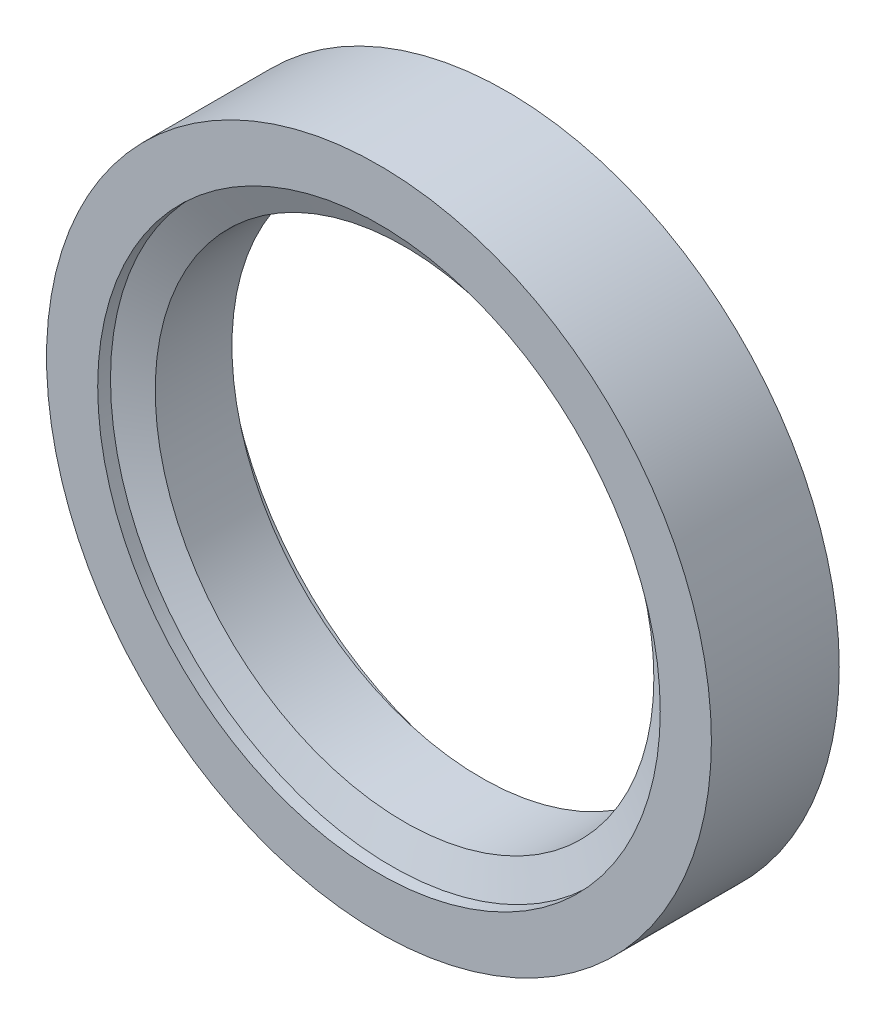
from build123d import *

# Parameters (mm, degrees)
EXTRUDE_1_DEPTH      = 5
EXTRUDE_1_DEPTH_BACK = 5
SKETCH_1_R           = 26
SKETCH_1_R_2         = 22


with BuildPart() as part:
    # Эскиз1 → Бобышка-Вытянуть1 (new, two sides: drawn at the far end of the back side and taken through both)
    with BuildSketch(Plane.XY.offset(-EXTRUDE_1_DEPTH_BACK)):
        Circle(SKETCH_1_R)
        Circle(SKETCH_1_R_2, mode=Mode.SUBTRACT)
    extrude(amount=EXTRUDE_1_DEPTH + EXTRUDE_1_DEPTH_BACK)

    # Эскиз5 → Повернуть2 (revolve)
    with BuildSketch(Plane(origin=(0, 0, 0), x_dir=(0, 0, -1), z_dir=(1, 0, 0))):
        Polygon((-3, 19.5), (3, 19.5), (4, 22), (-4, 22), align=None)
    revolve(axis=Axis((0, 0, 5), (0, 0, -1)))


solid = part.part
